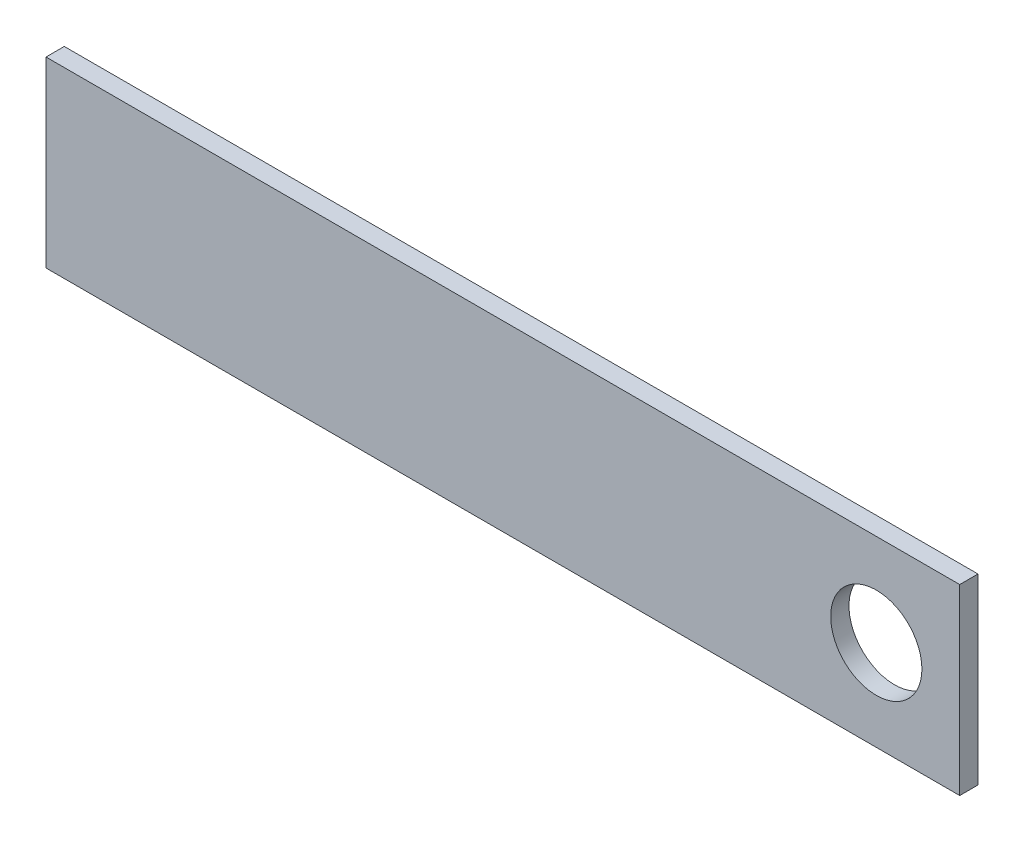
from build123d import *

# Parameters (mm, degrees)
SKETCH1_W           = 100
SKETCH1_H           = 2
BOSS_EXTRUDE1_DEPTH = 20
SKETCH3_R           = 4.991317005
CUT_EXTRUDE1_DEPTH  = 103


with BuildPart() as part:
    # Sketch1 → Boss-Extrude1 (new body)
    with BuildSketch(Plane(origin=(0, 0, 0), x_dir=(1, 0, 0), z_dir=(0, 1, 0))):
        with Locations((50, 1)):
            Rectangle(SKETCH1_W, SKETCH1_H)
    extrude(amount=BOSS_EXTRUDE1_DEPTH)

    # Sketch3 → Cut-Extrude1 (cut, through all)
    with BuildSketch(Plane.XY):
        with Locations((90.870063767, 9.919744194)):
            Circle(SKETCH3_R)
    extrude(amount=-CUT_EXTRUDE1_DEPTH, mode=Mode.SUBTRACT)


solid = part.part
